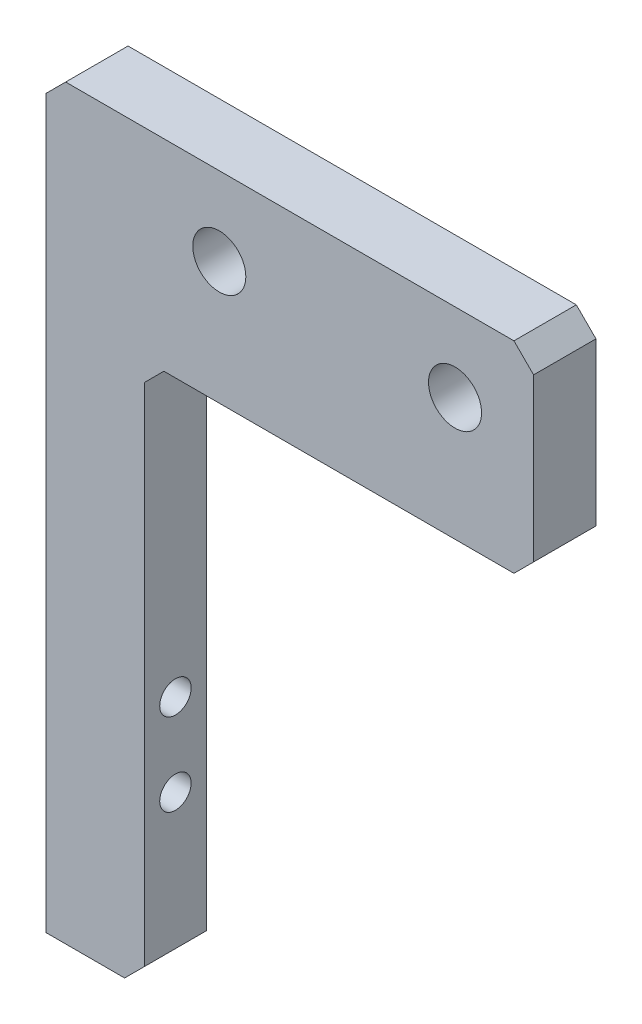
from build123d import *

# Parameters (mm, degrees)
BOSS_EXTRUDE1_DEPTH         = 3.175
M2_5_CLEARANCE_HOLE1_D      = 2.7
CHAMFER1_SIZE               = 1
TAP_DRILL_FOR_M2X0_4_TAP1_D = 1.6


with BuildPart() as part:
    # Sketch2 → Boss-Extrude1 (new body)
    with BuildSketch(Plane.XY):
        Polygon((-9.82, -6.25), (10, -6.25), (10, 4), (-14.82, 4), (-14.82, -34), (-9.82, -34), align=None)
    extrude(amount=BOSS_EXTRUDE1_DEPTH)

    # M2.5 Clearance Hole1 (through all)
    with Locations(Plane.XY.offset(3.175)):
        with Locations((-6, 0), (6, 0)):
            Hole(M2_5_CLEARANCE_HOLE1_D / 2)

    # Chamfer1
    chamfer1_edges = [part.edges().sort_by_distance(p)[0] for p in [
        (-9.82, -34, 1.5875),
        (-14.82, 4, 1.5875),
        (10, 4, 1.5875),
        (10, -6.25, 1.5875),
        (-9.82, -6.25, 1.5875),
    ]]
    chamfer(chamfer1_edges, length=CHAMFER1_SIZE)

    # Tap Drill for M2x0.4 Tap1 (through all)
    with Locations(Plane.ZY.offset(14.82)):
        with Locations((1.5875, -21.9), (1.5875, -26.1)):
            Hole(TAP_DRILL_FOR_M2X0_4_TAP1_D / 2)


solid = part.part
